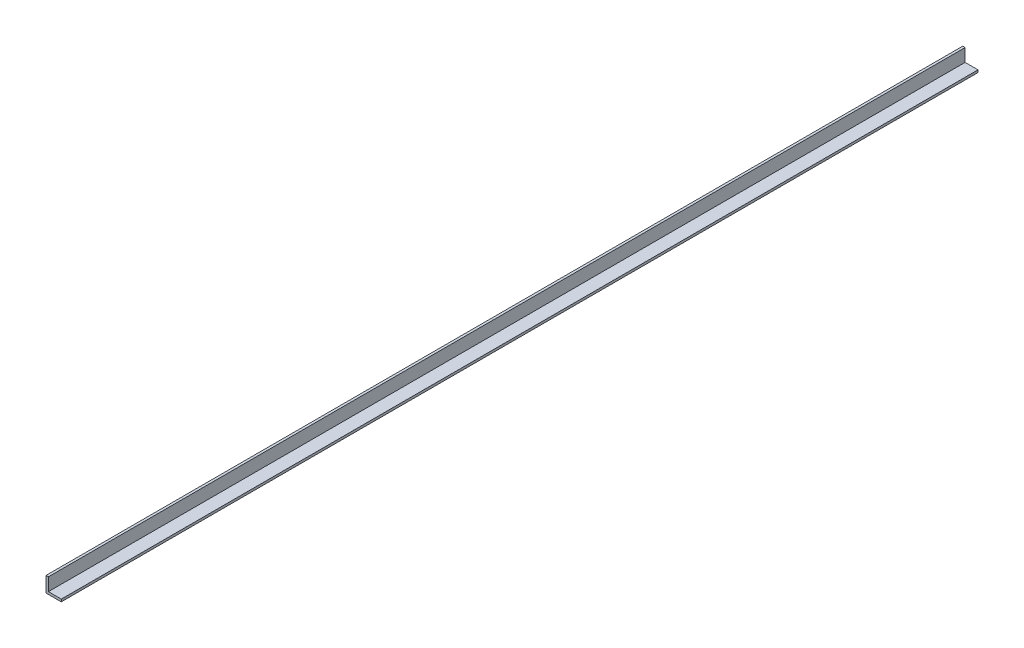
from build123d import *

# Parameters (mm, degrees)
SALIENTE_EXTRUIR1_DEPTH = 6100


with BuildPart() as part:
    # Croquis1 → Saliente-Extruir1 (new body)
    with BuildSketch(Plane.XY):
        Polygon((0, 101.6), (0, 0), (101.6, 0), (101.6, 15.88), (15.88, 15.88), (15.88, 101.6), align=None)
    extrude(amount=-SALIENTE_EXTRUIR1_DEPTH)


solid = part.part
